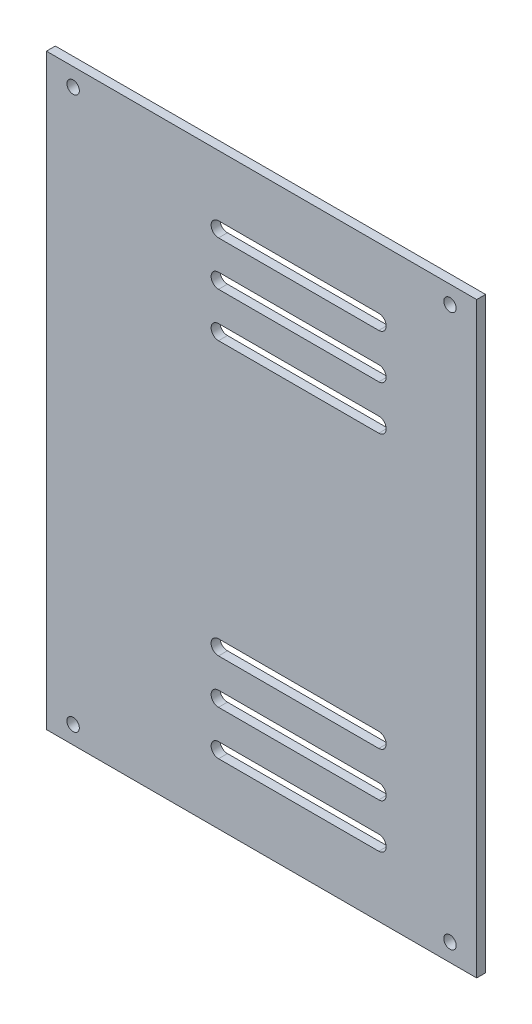
from build123d import *

# Parameters (mm, degrees)
SERVICE_LID_VENTS_PROFILE_W = 145
SERVICE_LID_VENTS_PROFILE_H = 198
SERVICE_LID_VENTS_PROFILE_R = 2.1
SERVICE_LID_VENTS_DEPTH     = 3


with BuildPart() as part:
    # Service lid vents profile → Service lid vents (new body)
    with BuildSketch(Plane.XY):
        with Locations((-18.5, 0)):
            Rectangle(SERVICE_LID_VENTS_PROFILE_W, SERVICE_LID_VENTS_PROFILE_H)
        with Locations((-82, -93)):
            Circle(SERVICE_LID_VENTS_PROFILE_R, mode=Mode.SUBTRACT)
        with Locations((-82, 93)):
            Circle(SERVICE_LID_VENTS_PROFILE_R, mode=Mode.SUBTRACT)
        with Locations((45, -93)):
            Circle(SERVICE_LID_VENTS_PROFILE_R, mode=Mode.SUBTRACT)
        with Locations((45, 93)):
            Circle(SERVICE_LID_VENTS_PROFILE_R, mode=Mode.SUBTRACT)
        with BuildLine():
            Line((-33, -78.5), (21, -78.5))
            ThreePointArc((21, -78.5), (23.5, -76), (21, -73.5))
            Line((21, -73.5), (-33, -73.5))
            ThreePointArc((-33, -73.5), (-35.5, -76), (-33, -78.5))
        make_face(mode=Mode.SUBTRACT)
        with BuildLine():
            Line((-33, -63.5), (21, -63.5))
            ThreePointArc((21, -63.5), (23.5, -61), (21, -58.5))
            Line((21, -58.5), (-33, -58.5))
            ThreePointArc((-33, -58.5), (-35.5, -61), (-33, -63.5))
        make_face(mode=Mode.SUBTRACT)
        with BuildLine():
            Line((-33, -48.5), (21, -48.5))
            ThreePointArc((21, -48.5), (23.5, -46), (21, -43.5))
            Line((21, -43.5), (-33, -43.5))
            ThreePointArc((-33, -43.5), (-35.5, -46), (-33, -48.5))
        make_face(mode=Mode.SUBTRACT)
        with BuildLine():
            Line((-33, 43.5), (21, 43.5))
            ThreePointArc((21, 43.5), (23.5, 46), (21, 48.5))
            Line((21, 48.5), (-33, 48.5))
            ThreePointArc((-33, 48.5), (-35.5, 46), (-33, 43.5))
        make_face(mode=Mode.SUBTRACT)
        with BuildLine():
            Line((-33, 58.5), (21, 58.5))
            ThreePointArc((21, 58.5), (23.5, 61), (21, 63.5))
            Line((21, 63.5), (-33, 63.5))
            ThreePointArc((-33, 63.5), (-35.5, 61), (-33, 58.5))
        make_face(mode=Mode.SUBTRACT)
        with BuildLine():
            Line((-33, 73.5), (21, 73.5))
            ThreePointArc((21, 73.5), (23.5, 76), (21, 78.5))
            Line((21, 78.5), (-33, 78.5))
            ThreePointArc((-33, 78.5), (-35.5, 76), (-33, 73.5))
        make_face(mode=Mode.SUBTRACT)
    extrude(amount=SERVICE_LID_VENTS_DEPTH)


solid = part.part
